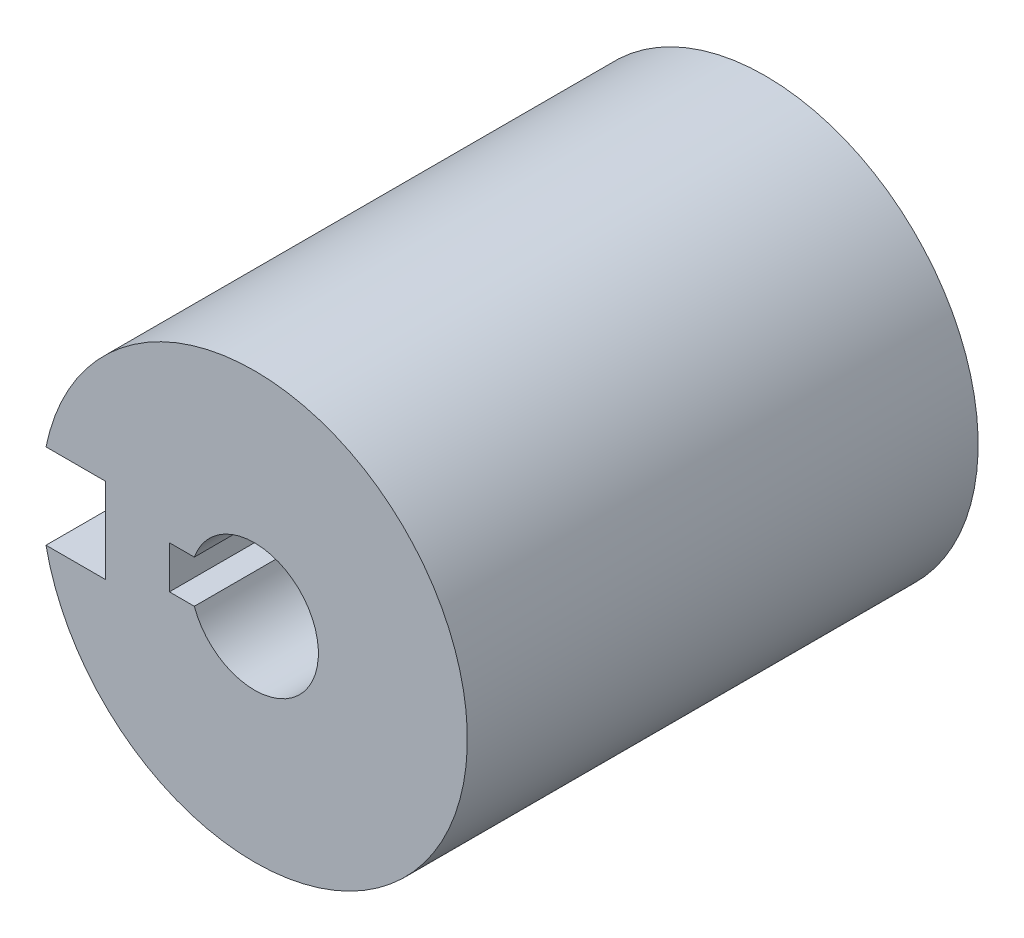
from build123d import *

# Parameters (mm, degrees)
SKETCH5_R           = 5
SKETCH5_R_2         = 1.5
BOSS_EXTRUDE2_DEPTH = 12
SKETCH6_W           = 1
SKETCH6_H           = 1
CUT_EXTRUDE4_DEPTH  = 12
SKETCH7_W           = 1
SKETCH7_H           = 1
CUT_EXTRUDE6_DEPTH  = 4
SKETCH8_W           = 3
SKETCH8_H           = 2
CUT_EXTRUDE7_DEPTH  = 15


with BuildPart() as part:
    # Sketch5 → Boss-Extrude2 (new body)
    with BuildSketch(Plane.XY):
        Circle(SKETCH5_R)
        Circle(SKETCH5_R_2, mode=Mode.SUBTRACT)
    extrude(amount=BOSS_EXTRUDE2_DEPTH)

    # Sketch6 → Cut-Extrude4 (cut)
    with BuildSketch(Plane.XY.offset(12)):
        with Locations((-1.5, 0)):
            Rectangle(SKETCH6_W, SKETCH6_H)
    extrude(amount=-CUT_EXTRUDE4_DEPTH, mode=Mode.SUBTRACT)

    # Sketch7 → Cut-Extrude6 (cut)
    with BuildSketch(Plane.XY.offset(12)):
        with Locations((-5, 0)):
            Rectangle(SKETCH7_W, SKETCH7_H)
    extrude(amount=-CUT_EXTRUDE6_DEPTH, mode=Mode.SUBTRACT)

    # Sketch8 → Cut-Extrude7 (cut)
    with BuildSketch(Plane(origin=(0, 0, 0), x_dir=(-1, 0, 0), z_dir=(0, 0, -1))):
        with Locations((5, 0)):
            Rectangle(SKETCH8_W, SKETCH8_H)
    extrude(amount=-CUT_EXTRUDE7_DEPTH, mode=Mode.SUBTRACT)


solid = part.part
